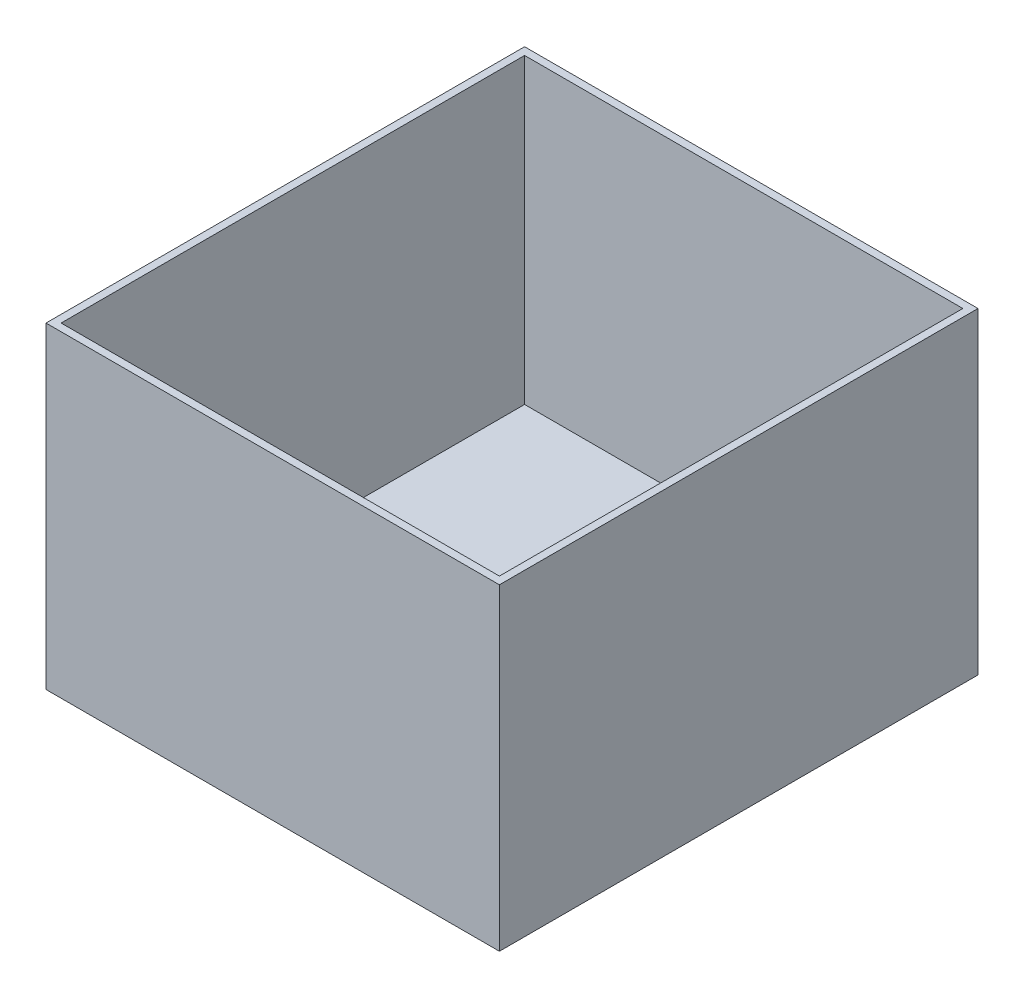
from build123d import *

# Parameters (mm, degrees)
SKETCH_1_W      = 90
SKETCH_1_H      = 95
EXTRUDE_1_DEPTH = 3
SKETCH_2_W      = 90
SKETCH_2_H      = 95
SKETCH_2_W_2    = 87
SKETCH_2_H_2    = 92
EXTRUDE_2_DEPTH = 60


with BuildPart() as part:
    # 草图1 → 凸台-拉伸1 (new body)
    with BuildSketch(Plane(origin=(0, 0, 0), x_dir=(1, 0, 0), z_dir=(0, 1, 0))):
        Rectangle(SKETCH_1_W, SKETCH_1_H)
    extrude(amount=-EXTRUDE_1_DEPTH)

    # 草图2 → 凸台-拉伸2 (add)
    with BuildSketch(Plane(origin=(0, 0, 0), x_dir=(1, 0, 0), z_dir=(0, 1, 0))):
        Rectangle(SKETCH_2_W, SKETCH_2_H)
        Rectangle(SKETCH_2_W_2, SKETCH_2_H_2, mode=Mode.SUBTRACT)
    extrude(amount=EXTRUDE_2_DEPTH)


solid = part.part
